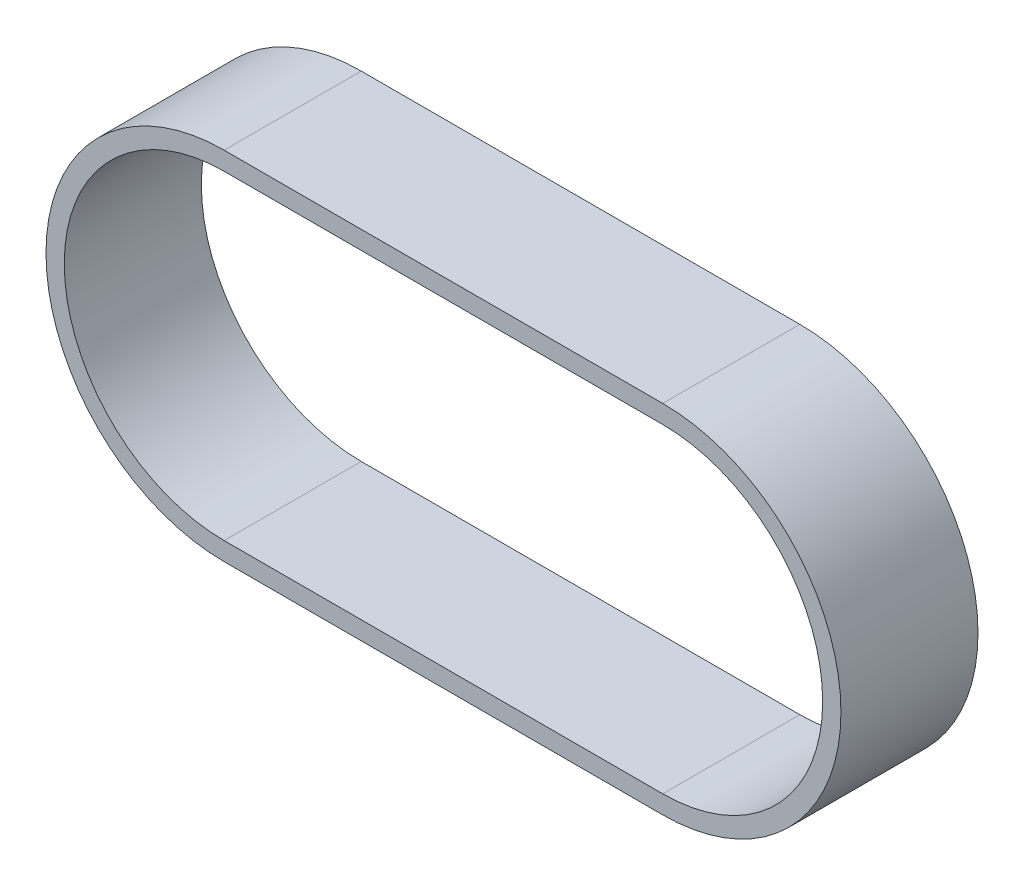
from build123d import *

# Parameters (mm, degrees)
BOSS_EXTRUDE1_DEPTH      = 7.5
BOSS_EXTRUDE1_DEPTH_BACK = 7.5


with BuildPart() as part:
    # Sketch1 → Boss-Extrude1 (new, two sides: drawn at the far end of the back side and taken through both)
    with BuildSketch(Plane.XY.offset(-BOSS_EXTRUDE1_DEPTH_BACK)):
        with BuildLine():
            Line((-24, 19.5), (24, 19.5))
            ThreePointArc((24, 19.5), (43.5, 0), (24, -19.5))
            Line((24, -19.5), (-24, -19.5))
            ThreePointArc((-24, -19.5), (-43.5, 0), (-24, 19.5))
        make_face()
        with BuildLine():
            Line((-24, 17.5), (24, 17.5))
            ThreePointArc((24, 17.5), (41.5, 0), (24, -17.5))
            Line((24, -17.5), (-24, -17.5))
            ThreePointArc((-24, -17.5), (-41.5, 0), (-24, 17.5))
        make_face(mode=Mode.SUBTRACT)
    extrude(amount=BOSS_EXTRUDE1_DEPTH + BOSS_EXTRUDE1_DEPTH_BACK)


solid = part.part
